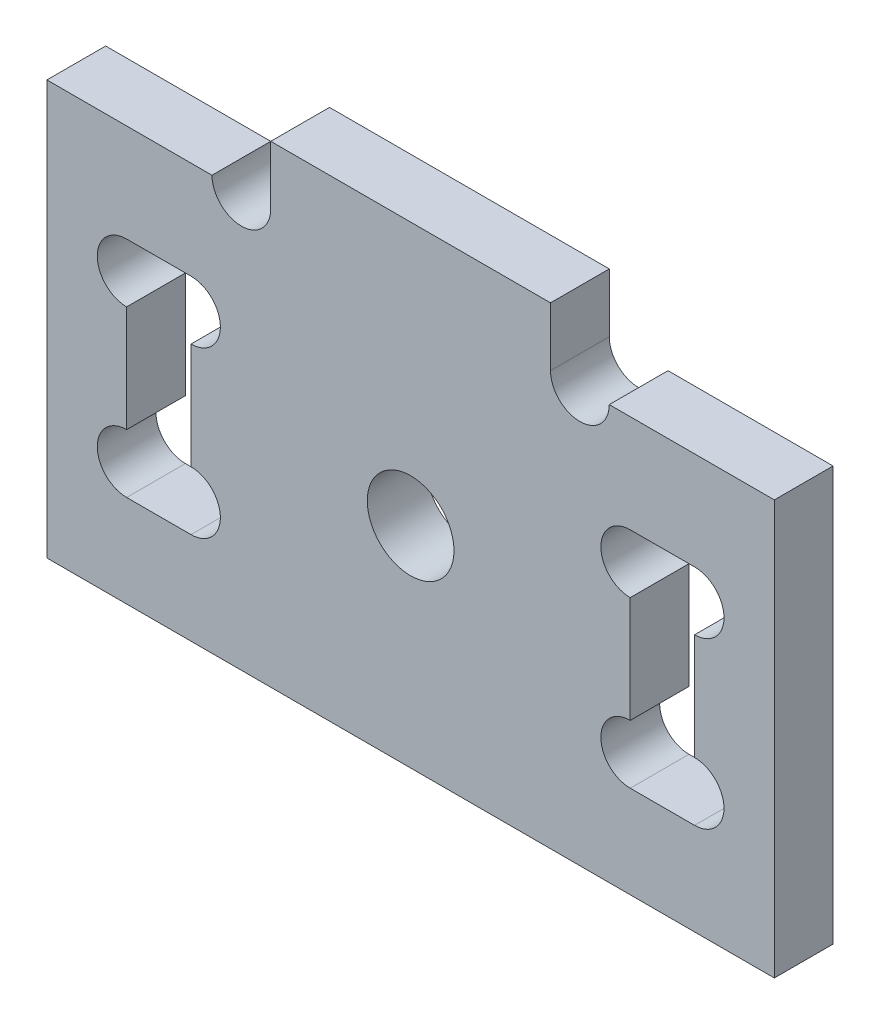
from build123d import *

# Parameters (mm, degrees)
SKETCH_1_R      = 1.55
EXTRUDE_1_DEPTH = 2.1


with BuildPart() as part:
    # 草图1 → 凸台-拉伸1 (new body)
    with BuildSketch(Plane.XY):
        with BuildLine():
            Line((-13, -7.4), (13, -7.4))
            Line((13, -7.4), (13, 7.4))
            Line((13, 7.4), (7.1, 7.4))
            ThreePointArc((7.1, 7.4), (6.05, 6.35), (5, 7.4))
            Line((5, 7.4), (5, 9.5))
            Line((5, 9.5), (-5, 9.5))
            Line((-5, 9.5), (-5, 7.4))
            ThreePointArc((-5, 7.4), (-6.05, 6.35), (-7.1, 7.4))
            Line((-7.1, 7.4), (-13, 7.4))
            Line((-13, 7.4), (-13, -7.4))
        make_face()
        with BuildLine():
            ThreePointArc((-6.8, -3.05), (-7.10753788, -3.79246212), (-7.85, -4.1))
            Line((-7.85, -4.1), (-10.15, -4.1))
            ThreePointArc((-10.15, -4.1), (-11.2, -3.05), (-10.15, -2))
            Line((-10.15, -2), (-10.15, 1.8))
            ThreePointArc((-10.15, 1.8), (-11.2, 2.85), (-10.15, 3.9))
            Line((-10.15, 3.9), (-7.85, 3.9))
            ThreePointArc((-7.85, 3.9), (-7.10753788, 3.59246212), (-6.8, 2.85))
            ThreePointArc((-6.8, 2.85), (-7.10753788, 2.10753788), (-7.85, 1.8))
            Line((-7.85, 1.8), (-7.85, -2))
            ThreePointArc((-7.85, -2), (-7.10753788, -2.30753788), (-6.8, -3.05))
        make_face(mode=Mode.SUBTRACT)
        with Locations((0, 0.1)):
            Circle(SKETCH_1_R, mode=Mode.SUBTRACT)
        with BuildLine():
            ThreePointArc((7.85, 1.8), (6.8, 2.85), (7.85, 3.9))
            Line((7.85, 3.9), (10.15, 3.9))
            ThreePointArc((10.15, 3.9), (10.89246212, 3.59246212), (11.2, 2.85))
            ThreePointArc((11.2, 2.85), (10.89246212, 2.10753788), (10.15, 1.8))
            Line((10.15, 1.8), (10.15, -2))
            ThreePointArc((10.15, -2), (10.89246212, -2.30753788), (11.2, -3.05))
            ThreePointArc((11.2, -3.05), (10.89246212, -3.79246212), (10.15, -4.1))
            Line((10.15, -4.1), (7.85, -4.1))
            ThreePointArc((7.85, -4.1), (6.8, -3.05), (7.85, -2))
            Line((7.85, -2), (7.85, 1.8))
        make_face(mode=Mode.SUBTRACT)
    extrude(amount=EXTRUDE_1_DEPTH)


solid = part.part
